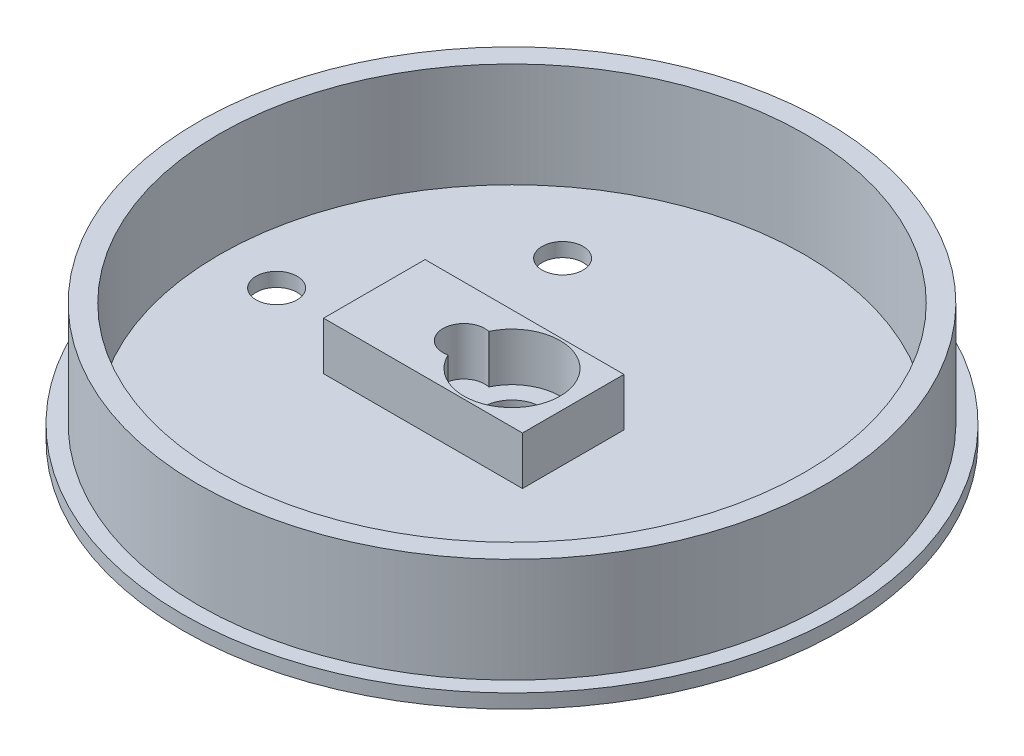
from build123d import *

# Parameters (mm, degrees)
SKETCH1_W           = 1.5875
SKETCH1_H           = 3.6703
BOSS_EXTRUDE1_DEPTH = 1.7018
BOSS_EXTRUDE2_START = 1.7018
SKETCH1_4_W         = 1.5875
SKETCH1_4_H         = 3.6703
BOSS_EXTRUDE2_DEPTH = 5.842
BOSS_EXTRUDE3_START = -7.5438
BOSS_EXTRUDE3_DEPTH = 1.7018
SKETCH5_R           = 40.005
BOSS_EXTRUDE5_DEPTH = 1.7018
SKETCH6_R           = 38.1
SKETCH6_R_2         = 35.56
BOSS_EXTRUDE6_DEPTH = 12.7


with BuildPart() as part:
    # Sketch1 → Boss-Extrude1 (new body)
    with BuildSketch(Plane(origin=(0, 0, 0), x_dir=(1, 0, 0), z_dir=(0, 1, 0))):
        with BuildLine():
            ThreePointArc((-24.13, 0), (-24.32485867, 1.301661891), (-24.892350361, 2.4892))
            Line((-24.892350361, 2.4892), (-28.575, 2.4892))
            ThreePointArc((-28.575, 2.4892), (-26.8148698, 1.7601302), (-26.0858, 0))
            ThreePointArc((-26.0858, 0), (-26.8148698, -1.7601302), (-28.575, -2.4892))
            Line((-28.575, -2.4892), (-24.892350361, -2.4892))
            ThreePointArc((-24.892350361, -2.4892), (-24.32485867, -1.301661891), (-24.13, 0))
        make_face()
        with BuildLine():
            Line((-28.575, 2.4892), (-24.892350361, 2.4892))
            ThreePointArc((-24.892350361, 2.4892), (-33.02, 0), (-24.892350361, -2.4892))
            Line((-24.892350361, -2.4892), (-28.575, -2.4892))
            ThreePointArc((-28.575, -2.4892), (-31.0642, 0), (-28.575, 2.4892))
        make_face()
        with BuildLine():
            ThreePointArc((-24.13, 0), (-24.32485867, 1.301661891), (-24.892350361, 2.4892))
            Line((-24.892350361, 2.4892), (-28.575, 2.4892))
            ThreePointArc((-28.575, 2.4892), (-26.8148698, 1.7601302), (-26.0858, 0))
            ThreePointArc((-26.0858, 0), (-26.8148698, -1.7601302), (-28.575, -2.4892))
            Line((-28.575, -2.4892), (-24.892350361, -2.4892))
            ThreePointArc((-24.892350361, -2.4892), (-24.32485867, -1.301661891), (-24.13, 0))
        make_face()
        with BuildLine():
            Line((-28.575, 2.4892), (-24.892350361, 2.4892))
            ThreePointArc((-24.892350361, 2.4892), (-33.02, 0), (-24.892350361, -2.4892))
            Line((-24.892350361, -2.4892), (-28.575, -2.4892))
            ThreePointArc((-28.575, -2.4892), (-31.0642, 0), (-28.575, 2.4892))
        make_face()
        with BuildLine():
            Line((-16.7132, 0), (-16.7132, 2.4892))
            Line((-16.7132, 2.4892), (-24.892350361, 2.4892))
            ThreePointArc((-24.892350361, 2.4892), (-24.32485867, 1.301661891), (-24.13, 0))
            ThreePointArc((-24.13, 0), (-24.32485867, -1.301661891), (-24.892350361, -2.4892))
            Line((-24.892350361, -2.4892), (-16.7132, -2.4892))
            Line((-16.7132, -2.4892), (-16.7132, 0))
        make_face()
        with BuildLine():
            Line((5.842, -6.1595), (5.842, -2.4892))
            Line((5.842, -2.4892), (5.285153485, -2.4892))
            ThreePointArc((5.285153485, -2.4892), (0, -5.842), (-5.285153485, -2.4892))
            Line((-5.285153485, -2.4892), (-5.336546382, -2.4892))
            ThreePointArc((-5.336546382, -2.4892), (-5.842, -2.54), (-6.347453618, -2.4892))
            Line((-6.347453618, -2.4892), (-16.7132, -2.4892))
            Line((-16.7132, -2.4892), (-16.7132, -6.1595))
            Line((-16.7132, -6.1595), (5.842, -6.1595))
        make_face()
        with BuildLine():
            Line((-16.7132, 0), (-16.7132, -2.4892))
            Line((-16.7132, -2.4892), (-6.347453618, -2.4892))
            ThreePointArc((-6.347453618, -2.4892), (-7.808653527, -1.607443282), (-8.382, 0))
            Line((-8.382, 0), (-16.7132, 0))
        make_face()
        with BuildLine():
            Line((-6.347453618, 2.4892), (-16.7132, 2.4892))
            Line((-16.7132, 2.4892), (-16.7132, 0))
            Line((-16.7132, 0), (-8.382, 0))
            ThreePointArc((-8.382, 0), (-7.808653527, 1.607443282), (-6.347453618, 2.4892))
        make_face()
        with BuildLine():
            Line((5.285153485, 2.4892), (5.842, 2.4892))
            Line((5.842, 2.4892), (5.842, 6.1595))
            Line((5.842, 6.1595), (-16.7132, 6.1595))
            Line((-16.7132, 6.1595), (-16.7132, 2.4892))
            Line((-16.7132, 2.4892), (-6.347453618, 2.4892))
            ThreePointArc((-6.347453618, 2.4892), (-5.842, 2.54), (-5.336546382, 2.4892))
            Line((-5.336546382, 2.4892), (-5.285153485, 2.4892))
            ThreePointArc((-5.285153485, 2.4892), (0, 5.842), (5.285153485, 2.4892))
        make_face()
        with Locations((6.63575, 4.32435)):
            Rectangle(SKETCH1_W, SKETCH1_H)
        with Locations((6.63575, -4.32435)):
            Rectangle(SKETCH1_W, SKETCH1_H)
        Polygon((5.842, 2.4892), (5.842, 0), (5.842, -2.4892), (7.4295, -2.4892), (7.4295, 2.4892), align=None)
        with BuildLine():
            ThreePointArc((5.285153485, 2.4892), (5.70108896, 1.275362172), (5.842, 0))
            Line((5.842, 0), (5.842, 2.4892))
            Line((5.842, 2.4892), (5.285153485, 2.4892))
        make_face()
        with BuildLine():
            Line((5.842, -2.4892), (5.842, 0))
            ThreePointArc((5.842, 0), (5.70108896, -1.275362172), (5.285153485, -2.4892))
            Line((5.285153485, -2.4892), (5.842, -2.4892))
        make_face()
        with BuildLine():
            ThreePointArc((5.285153485, -2.4892), (5.70108896, -1.275362172), (5.842, 0))
            Line((5.842, 0), (3.556, 0))
            ThreePointArc((3.556, 0), (3.292079083, -1.344377668), (2.539491949, -2.4892))
            Line((2.539491949, -2.4892), (5.285153485, -2.4892))
        make_face()
        with BuildLine():
            Line((3.556, 0), (5.842, 0))
            ThreePointArc((5.842, 0), (5.70108896, 1.275362172), (5.285153485, 2.4892))
            Line((5.285153485, 2.4892), (2.539491949, 2.4892))
            ThreePointArc((2.539491949, 2.4892), (3.292079083, 1.344377668), (3.556, 0))
        make_face()
        with BuildLine():
            Line((2.539491949, 2.4892), (5.285153485, 2.4892))
            ThreePointArc((5.285153485, 2.4892), (0, 5.842), (-5.285153485, 2.4892))
            Line((-5.285153485, 2.4892), (-2.539491949, 2.4892))
            ThreePointArc((-2.539491949, 2.4892), (0, 3.556), (2.539491949, 2.4892))
        make_face()
        with BuildLine():
            ThreePointArc((-5.285153485, -2.4892), (0, -5.842), (5.285153485, -2.4892))
            Line((5.285153485, -2.4892), (2.539491949, -2.4892))
            ThreePointArc((2.539491949, -2.4892), (0, -3.556), (-2.539491949, -2.4892))
            Line((-2.539491949, -2.4892), (-5.285153485, -2.4892))
        make_face()
        with BuildLine():
            ThreePointArc((-5.289826087, -2.479254721), (-5.287492124, -2.484228459), (-5.285153485, -2.4892))
            Line((-5.285153485, -2.4892), (-2.539491949, -2.4892))
            ThreePointArc((-2.539491949, -2.4892), (-3.104424534, -1.734267659), (-3.451086957, -0.857400034))
            ThreePointArc((-3.451086957, -0.857400034), (-4.161808533, -1.904877066), (-5.289826087, -2.479254721))
        make_face()
        with BuildLine():
            Line((-2.539491949, 2.4892), (-5.285153485, 2.4892))
            ThreePointArc((-5.285153485, 2.4892), (-5.287492124, 2.484228459), (-5.289826087, 2.479254721))
            ThreePointArc((-5.289826087, 2.479254721), (-4.161808533, 1.904877066), (-3.451086957, 0.857400034))
            ThreePointArc((-3.451086957, 0.857400034), (-3.104424534, 1.734267659), (-2.539491949, 2.4892))
        make_face()
        with BuildLine():
            Line((24.892350361, 2.4892), (7.4295, 2.4892))
            Line((7.4295, 2.4892), (7.4295, -2.4892))
            Line((7.4295, -2.4892), (24.892350361, -2.4892))
            ThreePointArc((24.892350361, -2.4892), (24.13, 0), (24.892350361, 2.4892))
        make_face()
        with BuildLine():
            ThreePointArc((33.02, 0), (29.876661891, 4.25014133), (24.892350361, 2.4892))
            Line((24.892350361, 2.4892), (28.575, 2.4892))
            ThreePointArc((28.575, 2.4892), (30.3351302, 1.7601302), (31.0642, 0))
            ThreePointArc((31.0642, 0), (30.3351302, -1.7601302), (28.575, -2.4892))
            Line((28.575, -2.4892), (24.892350361, -2.4892))
            ThreePointArc((24.892350361, -2.4892), (29.876661891, -4.25014133), (33.02, 0))
        make_face()
        with BuildLine():
            Line((28.575, 2.4892), (24.892350361, 2.4892))
            ThreePointArc((24.892350361, 2.4892), (24.13, 0), (24.892350361, -2.4892))
            Line((24.892350361, -2.4892), (28.575, -2.4892))
            ThreePointArc((28.575, -2.4892), (26.0858, 0), (28.575, 2.4892))
        make_face()
        with BuildLine():
            ThreePointArc((33.02, 0), (29.876661891, 4.25014133), (24.892350361, 2.4892))
            Line((24.892350361, 2.4892), (28.575, 2.4892))
            ThreePointArc((28.575, 2.4892), (30.3351302, 1.7601302), (31.0642, 0))
            ThreePointArc((31.0642, 0), (30.3351302, -1.7601302), (28.575, -2.4892))
            Line((28.575, -2.4892), (24.892350361, -2.4892))
            ThreePointArc((24.892350361, -2.4892), (29.876661891, -4.25014133), (33.02, 0))
        make_face()
        with BuildLine():
            Line((28.575, 2.4892), (24.892350361, 2.4892))
            ThreePointArc((24.892350361, 2.4892), (24.13, 0), (24.892350361, -2.4892))
            Line((24.892350361, -2.4892), (28.575, -2.4892))
            ThreePointArc((28.575, -2.4892), (26.0858, 0), (28.575, 2.4892))
        make_face()
        with BuildLine():
            ThreePointArc((-3.451086957, -0.857400034), (-3.529674292, -0.431897431), (-3.556, 0))
            Line((-3.556, 0), (-5.842, 0))
            ThreePointArc((-5.842, 0), (-5.702285857, -1.27), (-5.289826087, -2.479254721))
            ThreePointArc((-5.289826087, -2.479254721), (-4.161808533, -1.904877066), (-3.451086957, -0.857400034))
        make_face()
        with BuildLine():
            Line((-5.842, 0), (-3.556, 0))
            ThreePointArc((-3.556, 0), (-3.529674292, 0.431897431), (-3.451086957, 0.857400034))
            ThreePointArc((-3.451086957, 0.857400034), (-4.161808533, 1.904877066), (-5.289826087, 2.479254721))
            ThreePointArc((-5.289826087, 2.479254721), (-5.702285857, 1.27), (-5.842, 0))
        make_face()
        with BuildLine():
            ThreePointArc((-3.451086957, -0.857400034), (-3.529674292, -0.431897431), (-3.556, 0))
            Line((-3.556, 0), (-5.842, 0))
            ThreePointArc((-5.842, 0), (-5.702285857, -1.27), (-5.289826087, -2.479254721))
            ThreePointArc((-5.289826087, -2.479254721), (-4.161808533, -1.904877066), (-3.451086957, -0.857400034))
        make_face()
        with BuildLine():
            Line((-5.842, 0), (-3.556, 0))
            ThreePointArc((-3.556, 0), (-3.529674292, 0.431897431), (-3.451086957, 0.857400034))
            ThreePointArc((-3.451086957, 0.857400034), (-4.161808533, 1.904877066), (-5.289826087, 2.479254721))
            ThreePointArc((-5.289826087, 2.479254721), (-5.702285857, 1.27), (-5.842, 0))
        make_face()
        with BuildLine():
            Line((-6.347453618, 2.4892), (-5.336546382, 2.4892))
            ThreePointArc((-5.336546382, 2.4892), (-5.842, 2.54), (-6.347453618, 2.4892))
        make_face()
        with BuildLine():
            ThreePointArc((-5.289826087, 2.479254721), (-5.313162855, 2.48433719), (-5.336546382, 2.4892))
            Line((-5.336546382, 2.4892), (-6.347453618, 2.4892))
            ThreePointArc((-6.347453618, 2.4892), (-7.808653527, 1.607443282), (-8.382, 0))
            Line((-8.382, 0), (-5.842, 0))
            ThreePointArc((-5.842, 0), (-5.702285857, 1.27), (-5.289826087, 2.479254721))
        make_face()
        with BuildLine():
            ThreePointArc((-6.347453618, -2.4892), (-5.842, -2.54), (-5.336546382, -2.4892))
            Line((-5.336546382, -2.4892), (-6.347453618, -2.4892))
        make_face()
        with BuildLine():
            Line((-6.347453618, -2.4892), (-5.336546382, -2.4892))
            ThreePointArc((-5.336546382, -2.4892), (-5.313162855, -2.48433719), (-5.289826087, -2.479254721))
            ThreePointArc((-5.289826087, -2.479254721), (-5.702285857, -1.27), (-5.842, 0))
            Line((-5.842, 0), (-8.382, 0))
            ThreePointArc((-8.382, 0), (-7.808653527, -1.607443282), (-6.347453618, -2.4892))
        make_face()
        with BuildLine():
            Line((-5.336546382, -2.4892), (-5.285153485, -2.4892))
            ThreePointArc((-5.285153485, -2.4892), (-5.287492124, -2.484228459), (-5.289826087, -2.479254721))
            ThreePointArc((-5.289826087, -2.479254721), (-5.313162855, -2.48433719), (-5.336546382, -2.4892))
        make_face()
        with BuildLine():
            ThreePointArc((-5.289826087, 2.479254721), (-5.287492124, 2.484228459), (-5.285153485, 2.4892))
            Line((-5.285153485, 2.4892), (-5.336546382, 2.4892))
            ThreePointArc((-5.336546382, 2.4892), (-5.313162855, 2.48433719), (-5.289826087, 2.479254721))
        make_face()
    extrude(amount=BOSS_EXTRUDE1_DEPTH)

    # Sketch1<4> → Boss-Extrude2 (add)
    with BuildSketch(Plane(origin=(0, 0, 0), x_dir=(1, 0, 0), z_dir=(0, 1, 0)).offset(BOSS_EXTRUDE2_START)):
        with BuildLine():
            Line((5.842, -6.1595), (5.842, -2.4892))
            Line((5.842, -2.4892), (5.285153485, -2.4892))
            ThreePointArc((5.285153485, -2.4892), (0, -5.842), (-5.285153485, -2.4892))
            Line((-5.285153485, -2.4892), (-5.336546382, -2.4892))
            ThreePointArc((-5.336546382, -2.4892), (-5.842, -2.54), (-6.347453618, -2.4892))
            Line((-6.347453618, -2.4892), (-16.7132, -2.4892))
            Line((-16.7132, -2.4892), (-16.7132, -6.1595))
            Line((-16.7132, -6.1595), (5.842, -6.1595))
        make_face()
        with BuildLine():
            Line((-6.347453618, 2.4892), (-16.7132, 2.4892))
            Line((-16.7132, 2.4892), (-16.7132, 0))
            Line((-16.7132, 0), (-8.382, 0))
            ThreePointArc((-8.382, 0), (-7.808653527, 1.607443282), (-6.347453618, 2.4892))
        make_face()
        with BuildLine():
            Line((5.285153485, 2.4892), (5.842, 2.4892))
            Line((5.842, 2.4892), (5.842, 6.1595))
            Line((5.842, 6.1595), (-16.7132, 6.1595))
            Line((-16.7132, 6.1595), (-16.7132, 2.4892))
            Line((-16.7132, 2.4892), (-6.347453618, 2.4892))
            ThreePointArc((-6.347453618, 2.4892), (-5.842, 2.54), (-5.336546382, 2.4892))
            Line((-5.336546382, 2.4892), (-5.285153485, 2.4892))
            ThreePointArc((-5.285153485, 2.4892), (0, 5.842), (5.285153485, 2.4892))
        make_face()
        with Locations((6.63575, 4.32435)):
            Rectangle(SKETCH1_4_W, SKETCH1_4_H)
        Polygon((5.842, 2.4892), (5.842, 0), (5.842, -2.4892), (7.4295, -2.4892), (7.4295, 2.4892), align=None)
        with Locations((6.63575, -4.32435)):
            Rectangle(SKETCH1_4_W, SKETCH1_4_H)
        with BuildLine():
            Line((5.842, -2.4892), (5.842, 0))
            ThreePointArc((5.842, 0), (5.70108896, -1.275362172), (5.285153485, -2.4892))
            Line((5.285153485, -2.4892), (5.842, -2.4892))
        make_face()
        with BuildLine():
            ThreePointArc((5.285153485, 2.4892), (5.70108896, 1.275362172), (5.842, 0))
            Line((5.842, 0), (5.842, 2.4892))
            Line((5.842, 2.4892), (5.285153485, 2.4892))
        make_face()
        with BuildLine():
            Line((-16.7132, 0), (-16.7132, -2.4892))
            Line((-16.7132, -2.4892), (-6.347453618, -2.4892))
            ThreePointArc((-6.347453618, -2.4892), (-7.808653527, -1.607443282), (-8.382, 0))
            Line((-8.382, 0), (-16.7132, 0))
        make_face()
    extrude(amount=BOSS_EXTRUDE2_DEPTH)

    # Sketch3 → Boss-Extrude3 (add)
    with BuildSketch(Plane(origin=(0, 7.5438, 0), x_dir=(1, 0, 0), z_dir=(0, 1, 0)).offset(BOSS_EXTRUDE3_START)):
        with BuildLine():
            ThreePointArc((-11.858814555, 20.491088388), (-12.140067189, 19.34170374), (-12.92026809, 18.452055119))
            Line((-12.92026809, 18.452055119), (-11.798467296, 16.849957551))
            ThreePointArc((-11.798467296, 16.849957551), (-10.843974639, 17.756179018), (-10.196700231, 18.902184873))
            Line((-10.196700231, 18.902184873), (-12.308981287, 21.918834853))
            ThreePointArc((-12.308981287, 21.918834853), (-11.974022322, 21.239605264), (-11.858814555, 20.491088388))
        make_face()
        with BuildLine():
            Line((-14.274766768, 16.046691943), (-16.387047824, 19.063341923))
            ThreePointArc((-16.387047824, 19.063341923), (-15.775761021, 22.530121657), (-12.308981287, 21.918834853))
            Line((-12.308981287, 21.918834853), (-10.196700231, 18.902184873))
            ThreePointArc((-10.196700231, 18.902184873), (-9.97705258, 19.683179721), (-9.903014555, 20.491088388))
            ThreePointArc((-9.903014555, 20.491088388), (-17.516895384, 23.608173451), (-14.274766768, 16.046691943))
        make_face()
        with BuildLine():
            Line((-11.798467296, 16.849957551), (-12.92026809, 18.452055119))
            ThreePointArc((-12.92026809, 18.452055119), (-14.780259599, 18.039704929), (-16.387047824, 19.063341923))
            Line((-16.387047824, 19.063341923), (-14.274766768, 16.046691943))
            ThreePointArc((-14.274766768, 16.046691943), (-12.976492636, 16.26297384), (-11.798467296, 16.849957551))
        make_face()
        with BuildLine():
            Line((-4.312928332, 6.1595), (-11.798467296, 16.849957551))
            ThreePointArc((-11.798467296, 16.849957551), (-12.976492636, 16.26297384), (-14.274766768, 16.046691943))
            Line((-14.274766768, 16.046691943), (-7.351680438, 6.1595))
            Line((-7.351680438, 6.1595), (-4.312928332, 6.1595))
        make_face()
        with BuildLine():
            ThreePointArc((-10.196700231, 18.902184873), (-10.843974639, 17.756179018), (-11.798467296, 16.849957551))
            Line((-11.798467296, 16.849957551), (-4.312928332, 6.1595))
            Line((-4.312928332, 6.1595), (-1.274176225, 6.1595))
            Line((-1.274176225, 6.1595), (-10.196700231, 18.902184873))
        make_face()
        with BuildLine():
            Line((11.798467296, -16.849957551), (4.312928332, -6.1595))
            Line((4.312928332, -6.1595), (1.274176225, -6.1595))
            Line((1.274176225, -6.1595), (10.196700231, -18.902184873))
            ThreePointArc((10.196700231, -18.902184873), (10.843974639, -17.756179018), (11.798467296, -16.849957551))
        make_face()
        with BuildLine():
            Line((7.351680438, -6.1595), (4.312928332, -6.1595))
            Line((4.312928332, -6.1595), (11.798467296, -16.849957551))
            ThreePointArc((11.798467296, -16.849957551), (12.976492636, -16.26297384), (14.274766768, -16.046691943))
            Line((14.274766768, -16.046691943), (7.351680438, -6.1595))
        make_face()
        with BuildLine():
            ThreePointArc((18.793014555, -20.491088388), (17.465099619, -17.322207559), (14.274766768, -16.046691943))
            Line((14.274766768, -16.046691943), (16.387047824, -19.063341923))
            ThreePointArc((16.387047824, -19.063341923), (16.722006789, -19.742571512), (16.837214555, -20.491088388))
            ThreePointArc((16.837214555, -20.491088388), (15.096531431, -22.865080622), (12.308981287, -21.918834853))
            Line((12.308981287, -21.918834853), (10.196700231, -18.902184873))
            ThreePointArc((10.196700231, -18.902184873), (13.540105889, -24.862050363), (18.793014555, -20.491088388))
        make_face()
        with BuildLine():
            ThreePointArc((14.274766768, -16.046691943), (12.976492636, -16.26297384), (11.798467296, -16.849957551))
            Line((11.798467296, -16.849957551), (12.92026809, -18.452055119))
            ThreePointArc((12.92026809, -18.452055119), (14.780259599, -18.039704929), (16.387047824, -19.063341923))
            Line((16.387047824, -19.063341923), (14.274766768, -16.046691943))
        make_face()
        with BuildLine():
            Line((12.92026809, -18.452055119), (11.798467296, -16.849957551))
            ThreePointArc((11.798467296, -16.849957551), (10.843974639, -17.756179018), (10.196700231, -18.902184873))
            Line((10.196700231, -18.902184873), (12.308981287, -21.918834853))
            ThreePointArc((12.308981287, -21.918834853), (11.896631097, -20.058843344), (12.92026809, -18.452055119))
        make_face()
    extrude(amount=BOSS_EXTRUDE3_DEPTH)

    # Sketch5 → Boss-Extrude5 (add)
    with BuildSketch(Plane.XZ):
        with Locations(Location((0, 0, 0), (0, 0, 270))):
            Circle(SKETCH5_R)
        with BuildLine():
            Line((7.4295, 2.4892), (7.4295, 6.1595))
            Line((7.4295, 6.1595), (7.351680438, 6.1595))
            Line((7.351680438, 6.1595), (14.274766768, 16.046691943))
            ThreePointArc((14.274766768, 16.046691943), (16.897561815, 24.132219225), (10.196700231, 18.902184873))
            Line((10.196700231, 18.902184873), (1.274176225, 6.1595))
            Line((1.274176225, 6.1595), (-16.7132, 6.1595))
            Line((-16.7132, 6.1595), (-16.7132, 2.4892))
            Line((-16.7132, 2.4892), (-24.892350361, 2.4892))
            ThreePointArc((-24.892350361, 2.4892), (-33.02, 0), (-24.892350361, -2.4892))
            Line((-24.892350361, -2.4892), (-16.7132, -2.4892))
            Line((-16.7132, -2.4892), (-16.7132, -6.1595))
            Line((-16.7132, -6.1595), (-7.351680438, -6.1595))
            Line((-7.351680438, -6.1595), (-14.274766768, -16.046691943))
            ThreePointArc((-14.274766768, -16.046691943), (-16.897561815, -24.132219225), (-10.196700231, -18.902184873))
            Line((-10.196700231, -18.902184873), (-1.274176225, -6.1595))
            Line((-1.274176225, -6.1595), (7.4295, -6.1595))
            Line((7.4295, -6.1595), (7.4295, -2.4892))
            Line((7.4295, -2.4892), (24.892350361, -2.4892))
            ThreePointArc((24.892350361, -2.4892), (33.02, 0), (24.892350361, 2.4892))
            Line((24.892350361, 2.4892), (7.4295, 2.4892))
        make_face(mode=Mode.SUBTRACT)
    extrude(amount=-BOSS_EXTRUDE5_DEPTH)

    # Sketch6 → Boss-Extrude6 (add)
    with BuildSketch(Plane(origin=(0, 1.7018, 0), x_dir=(1, 0, 0), z_dir=(0, 1, 0))):
        with Locations(Location((0, 0, 0), (0, 0, 270))):
            Circle(SKETCH6_R)
        with Locations(Location((0, 0, 0), (0, 0, 270))):
            Circle(SKETCH6_R_2, mode=Mode.SUBTRACT)
    extrude(amount=BOSS_EXTRUDE6_DEPTH)


solid = part.part
